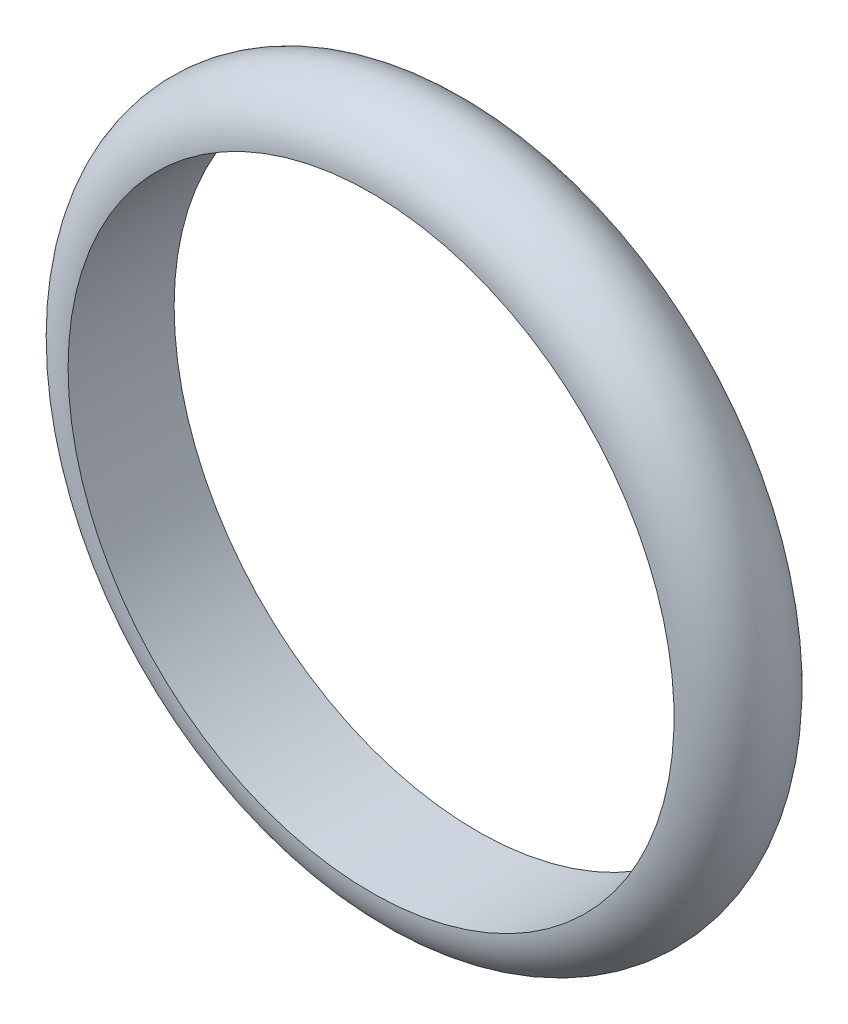
from build123d import *

# Parameters (mm, degrees)
SKETCH_1_R          = 25
EXTRUDE_1_DEPTH     = 7
SKETCH_2_R          = 20
CUT_EXTRUDE_1_DEPTH = 31
SCALE_1_SCALE       = 1.5


with BuildPart() as part:
    # 草图1 → 凸台-拉伸1 (new body)
    with BuildSketch(Plane.XY):
        Circle(SKETCH_1_R)
    extrude(amount=EXTRUDE_1_DEPTH)

    # 草图2 → 切除-拉伸1 (cut)
    with BuildSketch(Plane.XY.offset(7)):
        Circle(SKETCH_2_R)
    extrude(amount=-CUT_EXTRUDE_1_DEPTH, mode=Mode.SUBTRACT)

    # 草图7 → 切除-旋转1 (revolve, cut)
    with BuildSketch(Plane(origin=(0, 0, 0), x_dir=(0, -1, 0), z_dir=(-1, 0, 0)), mode=Mode.PRIVATE) as cut_revolve_1_sk:
        with BuildLine():
            Line((-20, 7), (-25, 7))
            Line((-25, 7), (-25, 0))
            Line((-25, 0), (-20, 0))
            ThreePointArc((-20, 0), (-23.5, 3.5), (-20, 7))
        make_face()
    revolve(cut_revolve_1_sk.sketch.rotate(Axis((0, 0, 0), (0, 0, 1)), 90), axis=Axis((0, 0, 0), (0, 0, 1)), mode=Mode.SUBTRACT)


with BuildPart() as part_1:
    # 缩放比例1: scaled about (0, 0, 3.5)
    add(part.part.scale(SCALE_1_SCALE).moved(Location((0, 0, -1.75))))


solid = part_1.part
